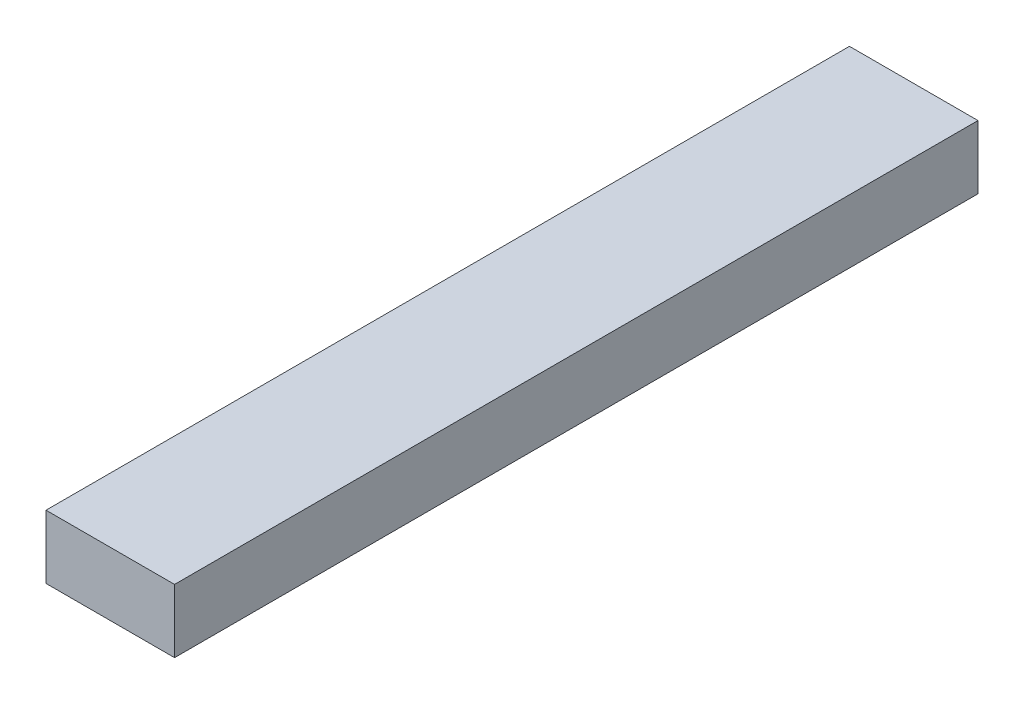
from build123d import *

# Parameters (mm, degrees)
SKETCH1_W           = 9.44
SKETCH1_H           = 4.66
BOSS_EXTRUDE1_DEPTH = 59


with BuildPart() as part:
    # Sketch1 → Boss-Extrude1 (new body)
    with BuildSketch(Plane.XY):
        Rectangle(SKETCH1_W, SKETCH1_H)
    extrude(amount=BOSS_EXTRUDE1_DEPTH)


solid = part.part
